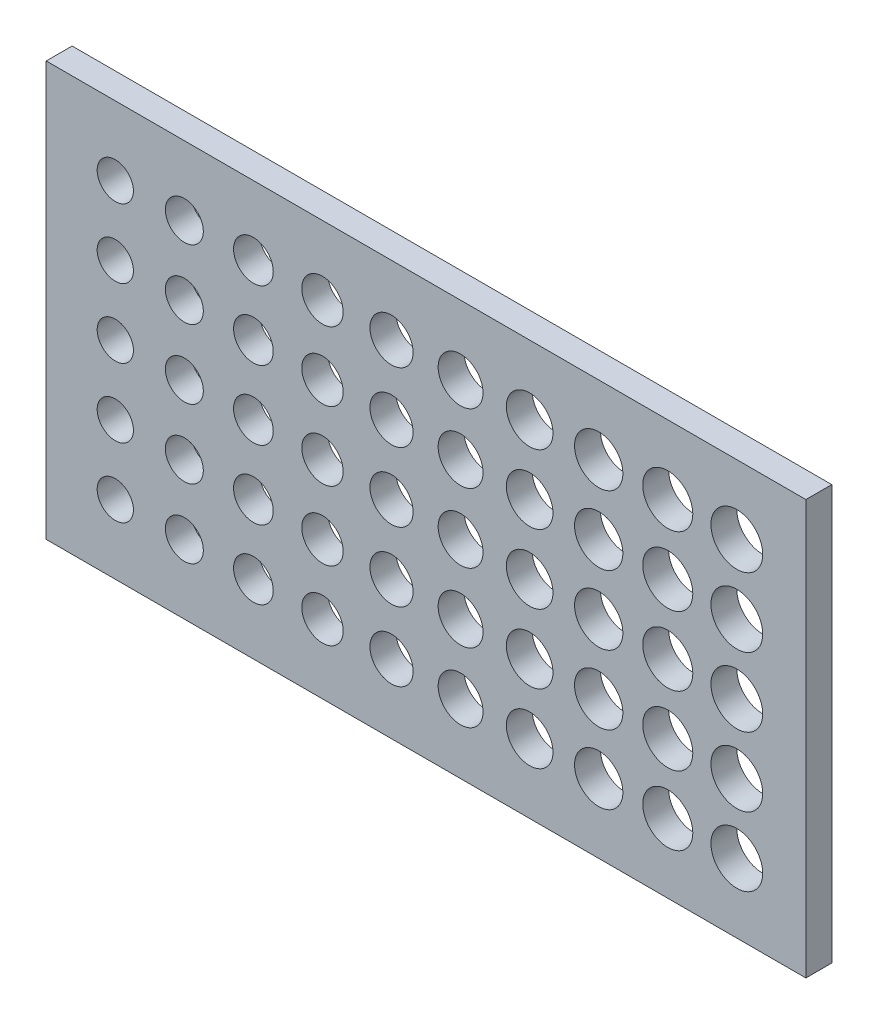
from build123d import *

# Parameters (mm, degrees)
SKETCH_3_W           = 44
SKETCH_3_H           = 24
EXTRUDE_2_DEPTH      = 1.5
SKETCH_4_R           = 1.05
CUT_EXTRUDE_1_DEPTH  = 1.5
SKETCH_5_R           = 1.1
CUT_EXTRUDE_2_DEPTH  = 1.5
SKETCH_6_R           = 1.15
CUT_EXTRUDE_3_DEPTH  = 1.5
SKETCH_7_R           = 1.2
CUT_EXTRUDE_4_DEPTH  = 1.5
SKETCH_8_R           = 1.25
CUT_EXTRUDE_6_DEPTH  = 1.5
SKETCH_10_R          = 1.3
CUT_EXTRUDE_7_DEPTH  = 1.5
SKETCH_11_R          = 1.35
CUT_EXTRUDE_8_DEPTH  = 1.5
SKETCH_12_R          = 1.4
CUT_EXTRUDE_9_DEPTH  = 1.5
SKETCH_13_R          = 1.45
CUT_EXTRUDE_10_DEPTH = 1.5
SKETCH_14_R          = 1.5
CUT_EXTRUDE_11_DEPTH = 1.5


with BuildPart() as part:
    # 草图3 → 凸台-拉伸2 (new body)
    with BuildSketch(Plane.XY):
        with Locations((22, 12)):
            Rectangle(SKETCH_3_W, SKETCH_3_H)
    extrude(amount=EXTRUDE_2_DEPTH)

    # 草图4 → 切除-拉伸1 (cut)
    with BuildSketch(Plane.XY):
        with Locations((4, 4)):
            Circle(SKETCH_4_R)
        with Locations((4, 8)):
            Circle(SKETCH_4_R)
        with Locations((4, 12)):
            Circle(SKETCH_4_R)
        with Locations((4, 16)):
            Circle(SKETCH_4_R)
        with Locations((4, 20)):
            Circle(SKETCH_4_R)
    extrude(amount=CUT_EXTRUDE_1_DEPTH, mode=Mode.SUBTRACT)

    # 草图5 → 切除-拉伸2 (cut)
    with BuildSketch(Plane.XY):
        with Locations((8, 4)):
            Circle(SKETCH_5_R)
        with Locations((8, 8)):
            Circle(SKETCH_5_R)
        with Locations((8, 12)):
            Circle(SKETCH_5_R)
        with Locations((8, 16)):
            Circle(SKETCH_5_R)
        with Locations((8, 20)):
            Circle(SKETCH_5_R)
    extrude(amount=CUT_EXTRUDE_2_DEPTH, mode=Mode.SUBTRACT)

    # 草图6 → 切除-拉伸3 (cut)
    with BuildSketch(Plane.XY):
        with Locations((12, 4)):
            Circle(SKETCH_6_R)
        with Locations((12, 8)):
            Circle(SKETCH_6_R)
        with Locations((12, 12)):
            Circle(SKETCH_6_R)
        with Locations((12, 16)):
            Circle(SKETCH_6_R)
        with Locations((12, 20)):
            Circle(SKETCH_6_R)
    extrude(amount=CUT_EXTRUDE_3_DEPTH, mode=Mode.SUBTRACT)

    # 草图7 → 切除-拉伸4 (cut)
    with BuildSketch(Plane.XY):
        with Locations((16, 4)):
            Circle(SKETCH_7_R)
        with Locations((16, 8)):
            Circle(SKETCH_7_R)
        with Locations((16, 12)):
            Circle(SKETCH_7_R)
        with Locations((16, 16)):
            Circle(SKETCH_7_R)
        with Locations((16, 20)):
            Circle(SKETCH_7_R)
    extrude(amount=CUT_EXTRUDE_4_DEPTH, mode=Mode.SUBTRACT)

    # 草图8 → 切除-拉伸6 (cut)
    with BuildSketch(Plane.XY):
        with Locations((20, 4)):
            Circle(SKETCH_8_R)
        with Locations((20, 8)):
            Circle(SKETCH_8_R)
        with Locations((20, 12)):
            Circle(SKETCH_8_R)
        with Locations((20, 16)):
            Circle(SKETCH_8_R)
        with Locations((20, 20)):
            Circle(SKETCH_8_R)
    extrude(amount=CUT_EXTRUDE_6_DEPTH, mode=Mode.SUBTRACT)

    # 草图10 → 切除-拉伸7 (cut)
    with BuildSketch(Plane.XY):
        with Locations((24, 4)):
            Circle(SKETCH_10_R)
        with Locations((24, 8)):
            Circle(SKETCH_10_R)
        with Locations((24, 12)):
            Circle(SKETCH_10_R)
        with Locations((24, 16)):
            Circle(SKETCH_10_R)
        with Locations((24, 20)):
            Circle(SKETCH_10_R)
    extrude(amount=CUT_EXTRUDE_7_DEPTH, mode=Mode.SUBTRACT)

    # 草图11 → 切除-拉伸8 (cut)
    with BuildSketch(Plane.XY):
        with Locations((28, 4)):
            Circle(SKETCH_11_R)
        with Locations((28, 8)):
            Circle(SKETCH_11_R)
        with Locations((28, 12)):
            Circle(SKETCH_11_R)
        with Locations((28, 16)):
            Circle(SKETCH_11_R)
        with Locations((28, 20)):
            Circle(SKETCH_11_R)
    extrude(amount=CUT_EXTRUDE_8_DEPTH, mode=Mode.SUBTRACT)

    # 草图12 → 切除-拉伸9 (cut)
    with BuildSketch(Plane.XY):
        with Locations((32, 4)):
            Circle(SKETCH_12_R)
        with Locations((32, 8)):
            Circle(SKETCH_12_R)
        with Locations((32, 12)):
            Circle(SKETCH_12_R)
        with Locations((32, 16)):
            Circle(SKETCH_12_R)
        with Locations((32, 20)):
            Circle(SKETCH_12_R)
    extrude(amount=CUT_EXTRUDE_9_DEPTH, mode=Mode.SUBTRACT)

    # 草图13 → 切除-拉伸10 (cut)
    with BuildSketch(Plane.XY):
        with Locations((36, 4)):
            Circle(SKETCH_13_R)
        with Locations((36, 8)):
            Circle(SKETCH_13_R)
        with Locations((36, 12)):
            Circle(SKETCH_13_R)
        with Locations((36, 16)):
            Circle(SKETCH_13_R)
        with Locations((36, 20)):
            Circle(SKETCH_13_R)
    extrude(amount=CUT_EXTRUDE_10_DEPTH, mode=Mode.SUBTRACT)

    # 草图14 → 切除-拉伸11 (cut)
    with BuildSketch(Plane.XY):
        with Locations((40, 4)):
            Circle(SKETCH_14_R)
        with Locations((40, 8)):
            Circle(SKETCH_14_R)
        with Locations((40, 12)):
            Circle(SKETCH_14_R)
        with Locations((40, 16)):
            Circle(SKETCH_14_R)
        with Locations((40, 20)):
            Circle(SKETCH_14_R)
    extrude(amount=CUT_EXTRUDE_11_DEPTH, mode=Mode.SUBTRACT)


solid = part.part
